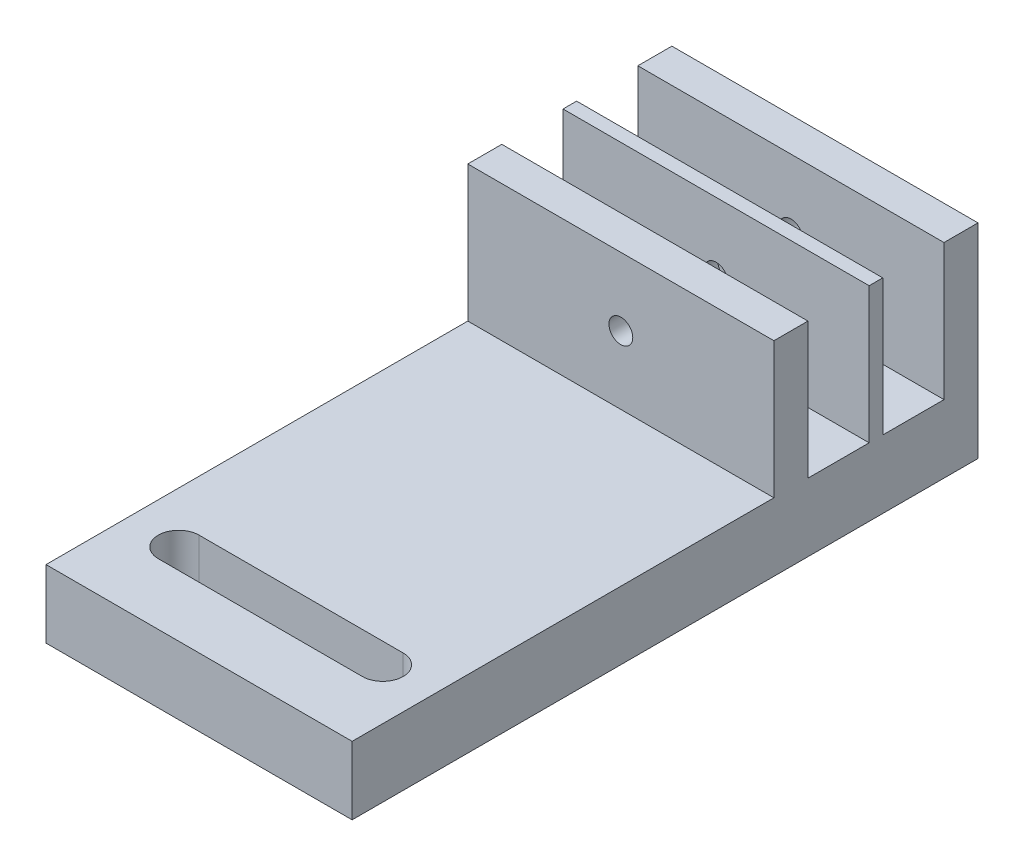
from build123d import *

# Parameters (mm, degrees)
SKETCH1_W           = 45
SKETCH1_H           = 57
BOSS_EXTRUDE1_DEPTH = 10
SKETCH4_W           = 45
SKETCH4_H           = 10
BOSS_EXTRUDE4_DEPTH = 35
SKETCH5_W           = 5
SKETCH5_H           = 20
SKETCH5_W_2         = 2
BOSS_EXTRUDE5_DEPTH = 45
CUT_EXTRUDE1_START  = -30
SKETCH6_R           = 1.75
CUT_EXTRUDE1_DEPTH  = 30


with BuildPart() as part:
    # Sketch1 → Boss-Extrude1 (new body)
    with BuildSketch(Plane(origin=(0, 0, 0), x_dir=(1, 0, 0), z_dir=(0, 1, 0))):
        Rectangle(SKETCH1_W, SKETCH1_H)
        with BuildLine():
            ThreePointArc((-15, -19.5), (-18, -16.5), (-15, -13.5))
            Line((-15, -13.5), (15, -13.5))
            ThreePointArc((15, -13.5), (17.121320344, -14.378679656), (18, -16.5))
            ThreePointArc((18, -16.5), (17.121320344, -18.621320344), (15, -19.5))
            Line((15, -19.5), (-15, -19.5))
        make_face(mode=Mode.SUBTRACT)
    extrude(amount=BOSS_EXTRUDE1_DEPTH)

    # Sketch4 → Boss-Extrude4 (add)
    with BuildSketch(Plane(origin=(0, 0, -28.5), x_dir=(-1, 0, 0), z_dir=(0, 0, -1))):
        with Locations((0, 5)):
            Rectangle(SKETCH4_W, SKETCH4_H)
    extrude(amount=BOSS_EXTRUDE4_DEPTH)

    # Sketch5 → Boss-Extrude5 (add)
    with BuildSketch(Plane(origin=(22.5, 0, 0), x_dir=(0, 0, -1), z_dir=(1, 0, 0))):
        with Locations((36, 20)):
            Rectangle(SKETCH5_W, SKETCH5_H)
        with Locations((48.5, 20)):
            Rectangle(SKETCH5_W_2, SKETCH5_H)
        with Locations((61, 20)):
            Rectangle(SKETCH5_W, SKETCH5_H)
    extrude(amount=-BOSS_EXTRUDE5_DEPTH)

    # Sketch6 → Cut-Extrude1 (cut)
    with BuildSketch(Plane.XY.offset(-33.5).offset(CUT_EXTRUDE1_START)):
        with Locations((0, 20)):
            Circle(SKETCH6_R)
    extrude(amount=CUT_EXTRUDE1_DEPTH, mode=Mode.SUBTRACT)


solid = part.part
